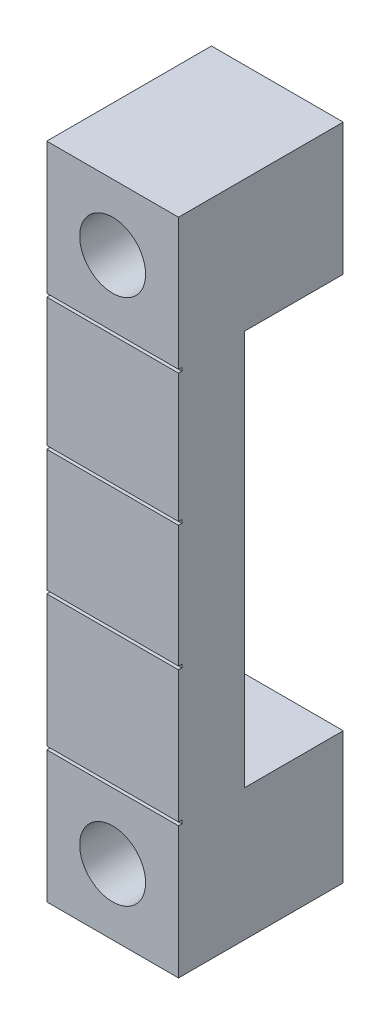
from build123d import *

# Parameters (mm, degrees)
SKETCH_1_W          = 20
SKETCH_1_H          = 100
EXTRUDE_1_DEPTH     = 10
SKETCH_2_W          = 20
SKETCH_2_H          = 20
EXTRUDE_2_DEPTH     = 15
SKETCH_3_R          = 3
CUT_EXTRUDE_1_DEPTH = 106
SKETCH_4_R          = 5
CUT_EXTRUDE_2_DEPTH = 15
SKETCH_5_W          = 20
SKETCH_5_H          = 0.5
CUT_EXTRUDE_3_DEPTH = 0.5


with BuildPart() as part:
    # 草图1 → 凸台-拉伸1 (new body)
    with BuildSketch(Plane.XY):
        with Locations((10, -50)):
            Rectangle(SKETCH_1_W, SKETCH_1_H)
    extrude(amount=EXTRUDE_1_DEPTH)

    # 草图2 → 凸台-拉伸2 (add)
    with BuildSketch(Plane(origin=(0, 0, 0), x_dir=(-1, 0, 0), z_dir=(0, 0, -1))):
        with Locations((-10, -10)):
            Rectangle(SKETCH_2_W, SKETCH_2_H)
        with Locations((-10, -90)):
            Rectangle(SKETCH_2_W, SKETCH_2_H)
    extrude(amount=EXTRUDE_2_DEPTH)

    # 草图3 → 切除-拉伸1 (cut, through all)
    with BuildSketch(Plane(origin=(0, 0, -15), x_dir=(-1, 0, 0), z_dir=(0, 0, -1))):
        with Locations((-10, -10)):
            Circle(SKETCH_3_R)
        with Locations((-10, -90)):
            Circle(SKETCH_3_R)
    extrude(amount=-CUT_EXTRUDE_1_DEPTH, mode=Mode.SUBTRACT)

    # 草图4 → 切除-拉伸2 (cut)
    with BuildSketch(Plane.XY.offset(10)):
        with Locations((10, -10)):
            Circle(SKETCH_4_R)
        with Locations((10, -90)):
            Circle(SKETCH_4_R)
    extrude(amount=-CUT_EXTRUDE_2_DEPTH, mode=Mode.SUBTRACT)

    # 草图5 → 切除-拉伸3 (cut)
    with BuildSketch(Plane.XY.offset(10)):
        with Locations((10, -79.75)):
            Rectangle(SKETCH_5_W, SKETCH_5_H)
        with Locations((10, -59.25)):
            Rectangle(SKETCH_5_W, SKETCH_5_H)
        with Locations((10, -40.25)):
            Rectangle(SKETCH_5_W, SKETCH_5_H)
        with Locations((10, -20.25)):
            Rectangle(SKETCH_5_W, SKETCH_5_H)
    extrude(amount=-CUT_EXTRUDE_3_DEPTH, mode=Mode.SUBTRACT)


solid = part.part
